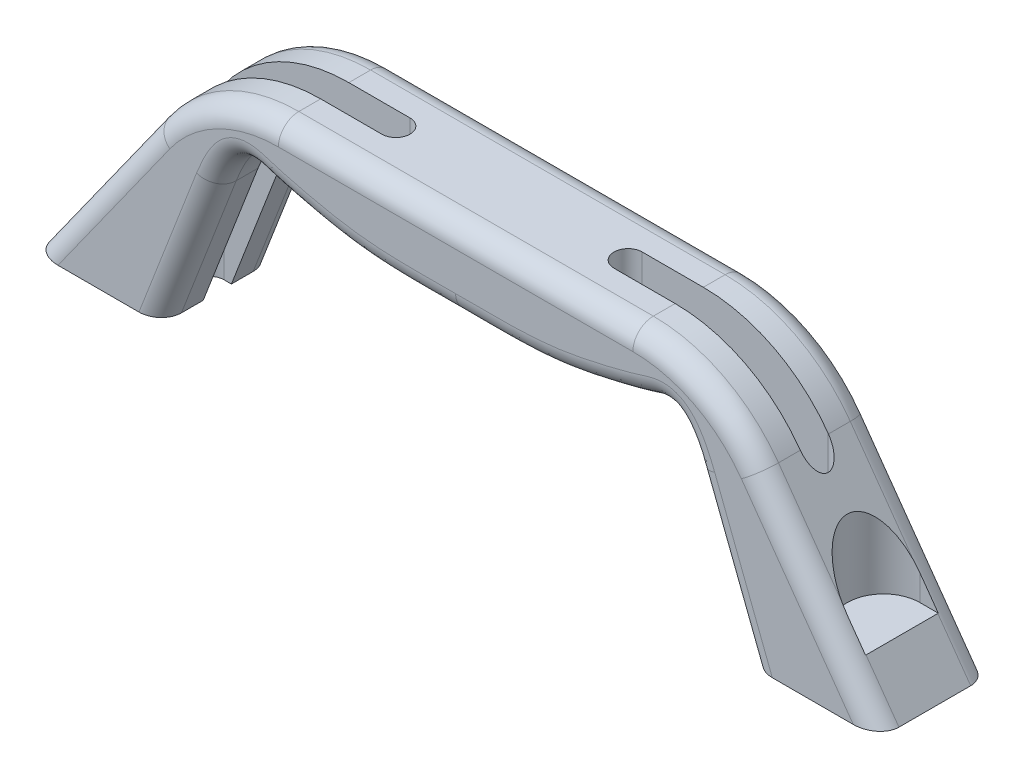
from build123d import *

# Parameters (mm, degrees)
BOSS_EXTRU_1_DEPTH      = 11
BOSS_EXTRU_1_DEPTH_BACK = 11
ENL_V_MAT_EXTRU_2_REACH = 96.855
CONG_1_R                = 4
ENL_V_MAT_EXTRU_3_DEPTH = 36.5


with BuildPart() as part:
    # Esquisse1 → Boss.-Extru.1 (new, two sides: drawn at the far end of the back side and taken through both)
    with BuildSketch(Plane.XY.offset(-BOSS_EXTRU_1_DEPTH_BACK)):
        with BuildLine():
            Line((46.809297653, 27.67741729), (57.5, 0))
            Line((57.5, 0), (82.5, 0))
            Line((82.5, 0), (59.002157318, 32.926714226))
            ThreePointArc((59.002157318, 32.926714226), (48.315850961, 42.172096157), (34.582705414, 45.5))
            Line((34.582705414, 45.5), (-34.582705414, 45.5))
            ThreePointArc((-34.582705414, 45.5), (-48.315850961, 42.172096157), (-59.002157318, 32.926714226))
            Line((-59.002157318, 32.926714226), (-82.5, 0))
            Line((-82.5, 0), (-57.5, 0))
            Line((-57.5, 0), (-46.809297653, 27.67741729))
            add(Edge.make_bspline(
                [(0, 30), (-7.847175593, 30), (-17.250445148, 29.746553244), (-29.672078406, 32.386021024), (-39.39234731, 34.950300085), (-43.279884198, 36.814800954), (-46.809297653, 27.67741729)],
                knots=[0, 0, 0, 0, 0.411284567, 0.644431405, 0.761424781, 1, 1, 1, 1], degree=3))
            add(Edge.make_bspline(
                [(0, 30), (7.847175593, 30), (17.250445148, 29.746553244), (29.672078406, 32.386021024), (39.39234731, 34.950300085), (43.279884198, 36.814800954), (46.809297653, 27.67741729)],
                knots=[0, 0, 0, 0, 0.411284567, 0.644431405, 0.761424781, 1, 1, 1, 1], degree=3))
        make_face()
    extrude(amount=BOSS_EXTRU_1_DEPTH + BOSS_EXTRU_1_DEPTH_BACK)

    # Enlèv. mat.-Extru.2: up to this face of the body (flat: up to its plane)
    enl_v_mat_extru_2_end = Plane(part.part.faces().sort_by_distance((-70, 0, 0))[0])
    # Esquisse2 → Enlèv. mat.-Extru.2 (cut, up to the picked face)
    with BuildSketch(Plane(origin=(0, 45.5, 0), x_dir=(1, 0, 0), z_dir=(0, 1, 0)), mode=Mode.PRIVATE) as enl_v_mat_extru_2_sk1:
        with BuildLine():
            Line((-58.95, 2.75), (-22.65, 2.75))
            ThreePointArc((-22.65, 2.75), (-19.9, 0), (-22.65, -2.75))
            Line((-22.65, -2.75), (-58.95, -2.75))
            ThreePointArc((-58.95, -2.75), (-61.7, 0), (-58.95, 2.75))
        make_face()
    enl_v_mat_extru_2_tool1 = split(extrude(enl_v_mat_extru_2_sk1.sketch, amount=-ENL_V_MAT_EXTRU_2_REACH, mode=Mode.PRIVATE), bisect_by=enl_v_mat_extru_2_end, keep=Keep.BOTH, mode=Mode.PRIVATE)
    # Esquisse2 → Enlèv. mat.-Extru.2 (cut, up to the picked face)
    with BuildSketch(Plane(origin=(0, 45.5, 0), x_dir=(1, 0, 0), z_dir=(0, 1, 0)), mode=Mode.PRIVATE) as enl_v_mat_extru_2_sk2:
        with BuildLine():
            Line((58.95, 2.75), (22.65, 2.75))
            ThreePointArc((22.65, 2.75), (19.9, 0), (22.65, -2.75))
            Line((22.65, -2.75), (58.95, -2.75))
            ThreePointArc((58.95, -2.75), (61.7, 0), (58.95, 2.75))
        make_face()
    enl_v_mat_extru_2_tool2 = split(extrude(enl_v_mat_extru_2_sk2.sketch, amount=-ENL_V_MAT_EXTRU_2_REACH, mode=Mode.PRIVATE), bisect_by=enl_v_mat_extru_2_end, keep=Keep.BOTH, mode=Mode.PRIVATE)
    add(enl_v_mat_extru_2_tool1.solids().sort_by(Axis((-40.8, 45.5, 0), (0, -1, 0)))[0], mode=Mode.SUBTRACT)
    add(enl_v_mat_extru_2_tool2.solids().sort_by(Axis((40.8, 45.5, 0), (0, -1, 0)))[0], mode=Mode.SUBTRACT)

    # Congé1
    cong_1_edges = [part.edges().sort_by_distance(p)[0] for p in [
        (-25.629466139, 31.583362095, -11),
        (25.629466139, 31.583362095, -11),
        (52.154648826, 13.838708645, -11),
        (70.751078659, 16.463357113, -11),
        (-52.154648826, 13.838708645, 11),
        (-25.629466139, 31.583362095, 11),
        (25.629466139, 31.583362095, 11),
        (48.315850961, 42.172096157, -11),
        (52.154648826, 13.838708645, 11),
        (70.751078659, 16.463357113, 11),
        (48.315850961, 42.172096157, 11),
        (0, 45.5, 11),
        (-48.315850961, 42.172096157, 11),
        (-70.751078659, 16.463357113, 11),
        (0, 45.5, -11),
        (-48.315850961, 42.172096157, -11),
        (-70.751078659, 16.463357113, -11),
        (-52.154648826, 13.838708645, -11),
    ]]
    fillet(cong_1_edges, radius=CONG_1_R)

    # Esquisse3 → Enlèv. mat.-Extru.3 (cut)
    with BuildSketch(Plane(origin=(0, 45.5, 0), x_dir=(1, 0, 0), z_dir=(0, 1, 0))):
        with BuildLine():
            Line((-72.5, 7.1), (-82.5, 7.1))
            Line((-82.5, 7.1), (-82.5, -7.1))
            Line((-82.5, -7.1), (-72.5, -7.1))
            ThreePointArc((-72.5, -7.1), (-65.4, 0), (-72.5, 7.1))
        make_face()
        with BuildLine():
            Line((82.5, -7.1), (72.5, -7.1))
            ThreePointArc((72.5, -7.1), (65.4, 0), (72.5, 7.1))
            Line((72.5, 7.1), (82.5, 7.1))
            Line((82.5, 7.1), (82.5, -7.1))
        make_face()
    extrude(amount=-ENL_V_MAT_EXTRU_3_DEPTH, mode=Mode.SUBTRACT)


solid = part.part
